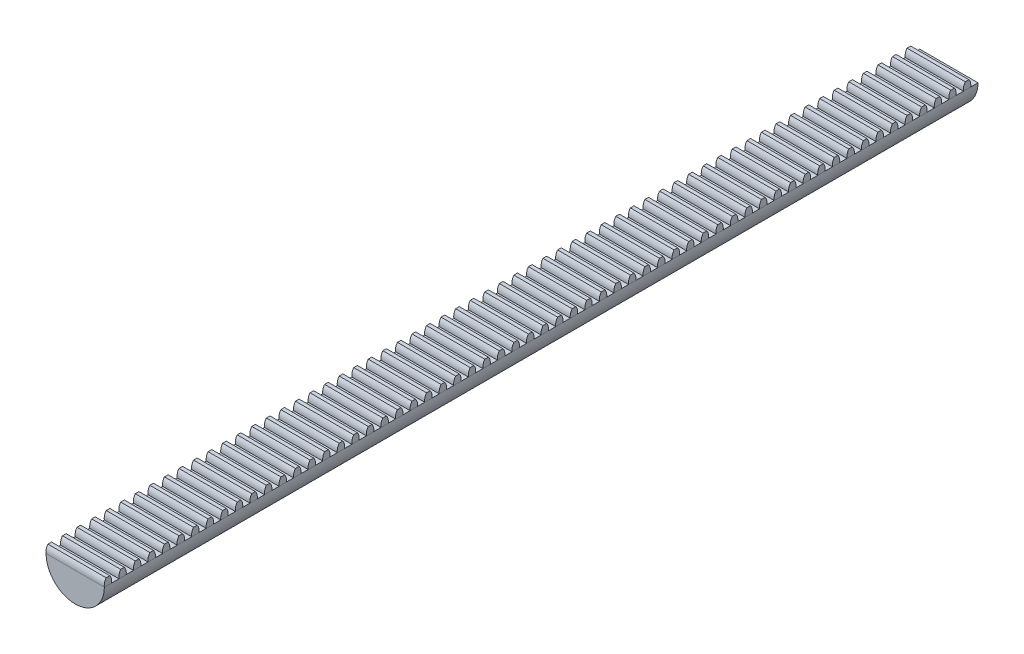
from build123d import *

# Parameters (mm, degrees)
BOSS_EXTRUDE1_DEPTH = 600
BOSS_EXTRUDE2_DEPTH = 20
LPATTERN1_COUNT     = 60
LPATTERN1_PITCH     = 10


with BuildPart() as part:
    # Sketch1 → Boss-Extrude1 (new body)
    with BuildSketch(Plane.XY):
        with BuildLine():
            Line((-20, 0), (20, 0))
            ThreePointArc((20, 0), (0, -20), (-20, 0))
        make_face()
    extrude(amount=BOSS_EXTRUDE1_DEPTH)

    # Sketch2 → Boss-Extrude2 (add, symmetric)
    with BuildSketch(Plane(origin=(0, 0, 0), x_dir=(0, 0, -1), z_dir=(1, 0, 0))):
        with BuildLine():
            Line((-598.75, 5), (-596.25, 5))
            add(Edge.make_bspline(
                [(-596.25, 5), (-594.623113342, 2.850447451), (-595, 0)],
                knots=[0, 0, 0, 1, 1, 1], degree=2))
            Line((-595, 0), (-600, 0))
            add(Edge.make_bspline(
                [(-600, 0), (-600.376886658, 2.850447451), (-598.75, 5)],
                knots=[0, 0, 0, 1, 1, 1], degree=2))
        make_face()
    boss_extrude2 = extrude(amount=BOSS_EXTRUDE2_DEPTH, both=True)

    # LPattern1: Boss-Extrude2 ×60
    with Locations(*[(0, 0, -i * LPATTERN1_PITCH) for i in range(1, LPATTERN1_COUNT)]):
        add(boss_extrude2)


solid = part.part
